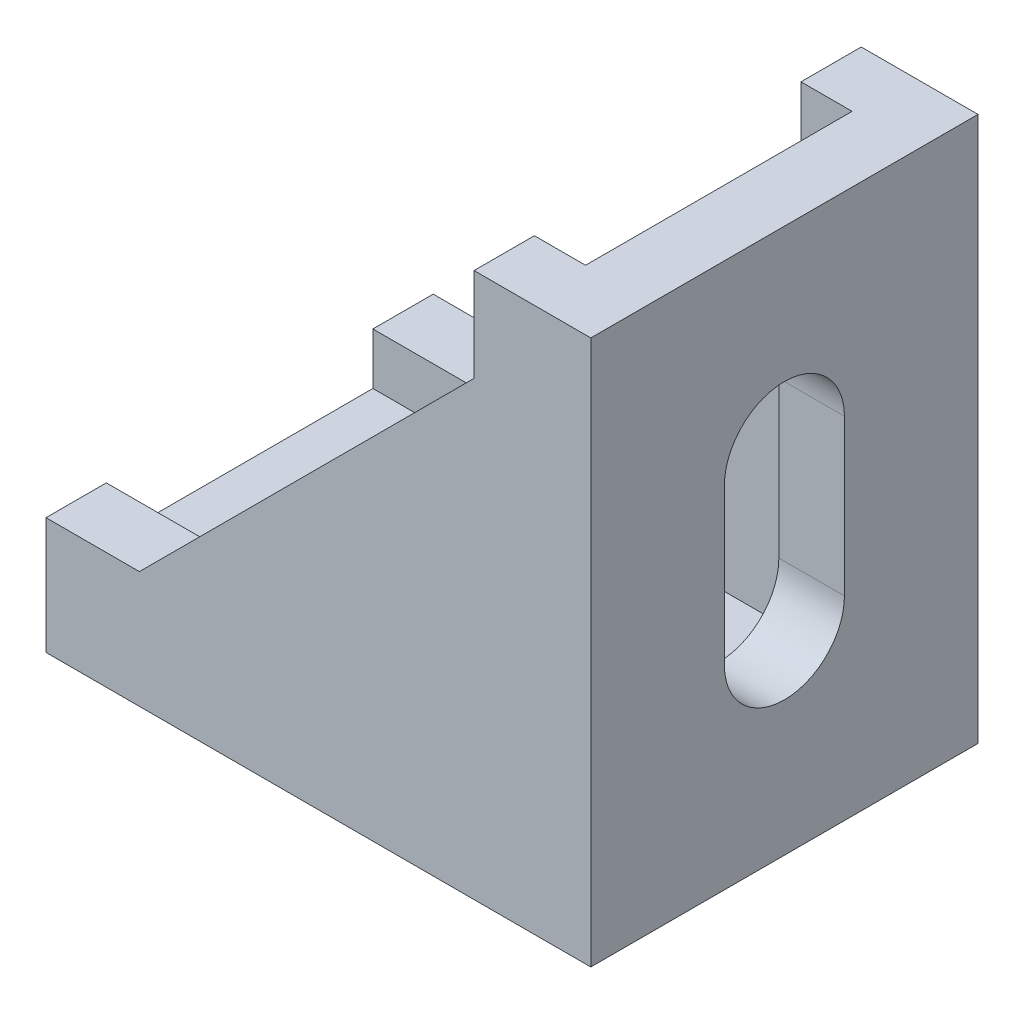
from build123d import *

# Parameters (mm, degrees)
SKETCH_1_W      = 28
SKETCH_1_H      = 19.9
EXTRUDE_1_DEPTH = 3.35
EXTRUDE_2_DEPTH = 3.1
EXTRUDE_START   = -16.8
EXTRUDE_3_DEPTH = 3.1
SKETCH_4_W      = 19.9
SKETCH_4_H      = 28
EXTRUDE_4_DEPTH = 3.37


with BuildPart() as part:
    # 草图1 → 凸台-拉伸1 (new body)
    with BuildSketch(Plane(origin=(0, 0, 0), x_dir=(1, 0, 0), z_dir=(0, 1, 0))):
        Rectangle(SKETCH_1_W, SKETCH_1_H)
        with BuildLine():
            Line((-4, 3.085), (4, 3.085))
            ThreePointArc((4, 3.085), (7.085, 0), (4, -3.085))
            Line((4, -3.085), (-4, -3.085))
            ThreePointArc((-4, -3.085), (-7.085, 0), (-4, 3.085))
        make_face(mode=Mode.SUBTRACT)
    extrude(amount=EXTRUDE_1_DEPTH)

    # 草图3 → 凸台-拉伸2 (add)
    with BuildSketch(Plane.XY.offset(9.95)):
        Polygon((14, 0), (14, 28), (8, 28), (8, 23.2), (-9.2, 6), (-14, 6), (-14, 0), align=None)
    extrude(amount=-EXTRUDE_2_DEPTH)

    # 草图3<3> → 凸台-拉伸3 (add)
    with BuildSketch(Plane.XY.offset(9.95).offset(EXTRUDE_START)):
        Polygon((14, 0), (14, 28), (8, 28), (8, 23.2), (-9.2, 6), (-14, 6), (-14, 0), align=None)
    extrude(amount=-EXTRUDE_3_DEPTH)

    # 草图4 → 凸台-拉伸4 (add)
    with BuildSketch(Plane(origin=(14, 0, 0), x_dir=(0, 0, -1), z_dir=(1, 0, 0))):
        with Locations((0, 14)):
            Rectangle(SKETCH_4_W, SKETCH_4_H)
        with BuildLine():
            Line((3.085, 18), (3.085, 10))
            ThreePointArc((3.085, 10), (0, 6.915), (-3.085, 10))
            Line((-3.085, 10), (-3.085, 18))
            ThreePointArc((-3.085, 18), (0, 21.085), (3.085, 18))
        make_face(mode=Mode.SUBTRACT)
    extrude(amount=-EXTRUDE_4_DEPTH)


solid = part.part
